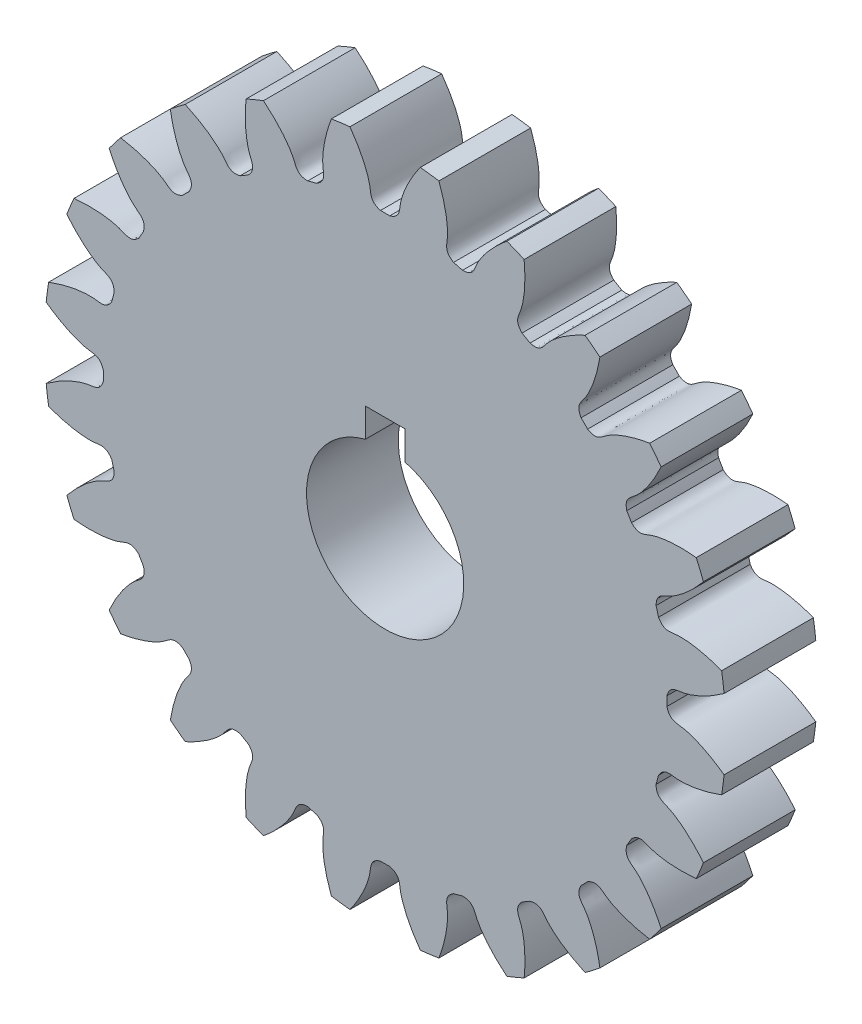
from build123d import *

# Parameters (mm, degrees)
SKETCH_1_R               = 26
EXTRUDE_1_DEPTH          = 7
CUT_EXTRUDE_1_DEPTH      = 38.429934544
PATTERN_CIRCULAR_1_COUNT = 24
CUT_EXTRUDE_2_REACH      = 39.237


with BuildPart() as part:
    # 草图1 → 凸台-拉伸1 (new body)
    with BuildSketch(Plane.XY):
        Circle(SKETCH_1_R)
    extrude(amount=EXTRUDE_1_DEPTH)

    # 草图2 → 切除-拉伸1 (cut, through all)
    with BuildSketch(Plane.XY):
        with BuildLine():
            ThreePointArc((0.353663825, 21.49709101), (0, 21.5), (-0.353663825, 21.49709101))
            add(Edge.make_bspline(
                [(-0.353663825, 21.49709101), (-1.135824432, 21.713720144), (-1.078095532, 22.231447194), (-1.172554353, 22.745368905), (-1.186071835, 22.811666085), (-1.202896967, 22.88648029), (-1.223361215, 22.96970543), (-1.247811268, 23.061221345), (-1.276584597, 23.160898741), (-1.310016843, 23.268597737), (-1.348439156, 23.384168443), (-1.392178653, 23.507450915), (-1.441557936, 23.638275308), (-1.496894885, 23.77646198), (-1.558502379, 23.92182162), (-1.626688044, 24.074155372), (-1.701753995, 24.233254975), (-1.783996581, 24.398902904), (-1.873706139, 24.570872518), (-1.971166747, 24.748928215), (-2.076655981, 24.932825595), (-2.190444683, 25.122311622), (-2.312796719, 25.317124804), (-2.443968757, 25.516995365), (-2.584210038, 25.721645435), (-2.733762158, 25.930789236), (-2.89285885, 26.144133282), (-3.061725774, 26.361376576), (-3.240580312, 26.582210822), (-3.429631368, 26.806320631), (-3.629079167, 27.033383741), (-3.83911507, 27.263071241), (-4.059921389, 27.495047793), (-4.291671202, 27.728971868), (-4.534528186, 27.964495978), (-4.788646443, 28.20126692), (-5.054170354, 28.438926019), (-5.331234348, 28.677109382), (-5.720844186, 28.998723112), (-6.023847611, 29.233756636), (-6.23123904, 29.388235858)],
                knots=[0, 0, 0, 0, 0.143961355, 0.149818462, 0.156576662, 0.164235955, 0.172796342, 0.182257821, 0.192620395, 0.203884061, 0.216048821, 0.229114674, 0.24308162, 0.25794966, 0.273718793, 0.290389019, 0.307960339, 0.326432751, 0.345806258, 0.366080857, 0.38725655, 0.409333336, 0.432311215, 0.456190188, 0.480970254, 0.506651413, 0.533233666, 0.560717012, 0.589101451, 0.618386984, 0.64857361, 0.679661329, 0.711650141, 0.744540047, 0.778331046, 0.813023138, 0.848616324, 0.885110603, 0.922505975, 1, 1, 1, 1], degree=3))
            ThreePointArc((-6.23123904, 29.388235858), (0, 30.041583627), (6.23123904, 29.388235858))
            add(Edge.make_bspline(
                [(0.353663825, 21.49709101), (1.135824432, 21.713720144), (1.078095532, 22.231447194), (1.172554353, 22.745368905), (1.186071835, 22.811666085), (1.202896967, 22.88648029), (1.223361215, 22.96970543), (1.247811268, 23.061221345), (1.276584597, 23.160898741), (1.310016843, 23.268597737), (1.348439156, 23.384168443), (1.392178653, 23.507450915), (1.441557936, 23.638275308), (1.496894885, 23.77646198), (1.558502379, 23.92182162), (1.626688044, 24.074155372), (1.701753995, 24.233254975), (1.783996581, 24.398902904), (1.873706139, 24.570872518), (1.971166747, 24.748928215), (2.076655981, 24.932825595), (2.190444683, 25.122311622), (2.312796719, 25.317124804), (2.443968757, 25.516995365), (2.584210038, 25.721645435), (2.733762158, 25.930789236), (2.89285885, 26.144133282), (3.061725774, 26.361376576), (3.240580312, 26.582210822), (3.429631368, 26.806320631), (3.629079167, 27.033383741), (3.83911507, 27.263071241), (4.059921389, 27.495047793), (4.291671202, 27.728971868), (4.534528186, 27.964495978), (4.788646443, 28.20126692), (5.054170354, 28.438926019), (5.331234348, 28.677109382), (5.720844186, 28.998723112), (6.023847611, 29.233756636), (6.23123904, 29.388235858)],
                knots=[0, 0, 0, 0, 0.143961355, 0.149818462, 0.156576662, 0.164235955, 0.172796342, 0.182257821, 0.192620395, 0.203884061, 0.216048821, 0.229114674, 0.24308162, 0.25794966, 0.273718793, 0.290389019, 0.307960339, 0.326432751, 0.345806258, 0.366080857, 0.38725655, 0.409333336, 0.432311215, 0.456190188, 0.480970254, 0.506651413, 0.533233666, 0.560717012, 0.589101451, 0.618386984, 0.64857361, 0.679661329, 0.711650141, 0.744540047, 0.778331046, 0.813023138, 0.848616324, 0.885110603, 0.922505975, 1, 1, 1, 1], degree=3))
        make_face()
    cut_extrude_1 = extrude(amount=CUT_EXTRUDE_1_DEPTH, mode=Mode.SUBTRACT)

    # 阵列(圆周)1: 切除-拉伸1 ×24 about axis
    pattern_circular_1_axis = Axis((0, 0, -0.5), (0, 0, 1))
    for i in range(1, PATTERN_CIRCULAR_1_COUNT):
        add(cut_extrude_1.rotate(pattern_circular_1_axis, i * 360 / PATTERN_CIRCULAR_1_COUNT), mode=Mode.SUBTRACT)

    # 草图4 → 切除-拉伸2 (cut, up to next)
    with BuildSketch(Plane.XY.offset(7), mode=Mode.PRIVATE) as cut_extrude_2_sk1:
        with BuildLine():
            Line((-1.5, 5.809475019), (-1.5, 8))
            Line((-1.5, 8), (1.5, 8))
            Line((1.5, 8), (1.5, 5.809475019))
            ThreePointArc((1.5, 5.809475019), (0, -6), (-1.5, 5.809475019))
        make_face()
    cut_extrude_2_tool1 = extrude(cut_extrude_2_sk1.sketch, amount=-CUT_EXTRUDE_2_REACH, mode=Mode.PRIVATE) & part.part
    add(cut_extrude_2_tool1.solids().sort_by_distance((0, 0.361524, 7))[0], mode=Mode.SUBTRACT)


solid = part.part
